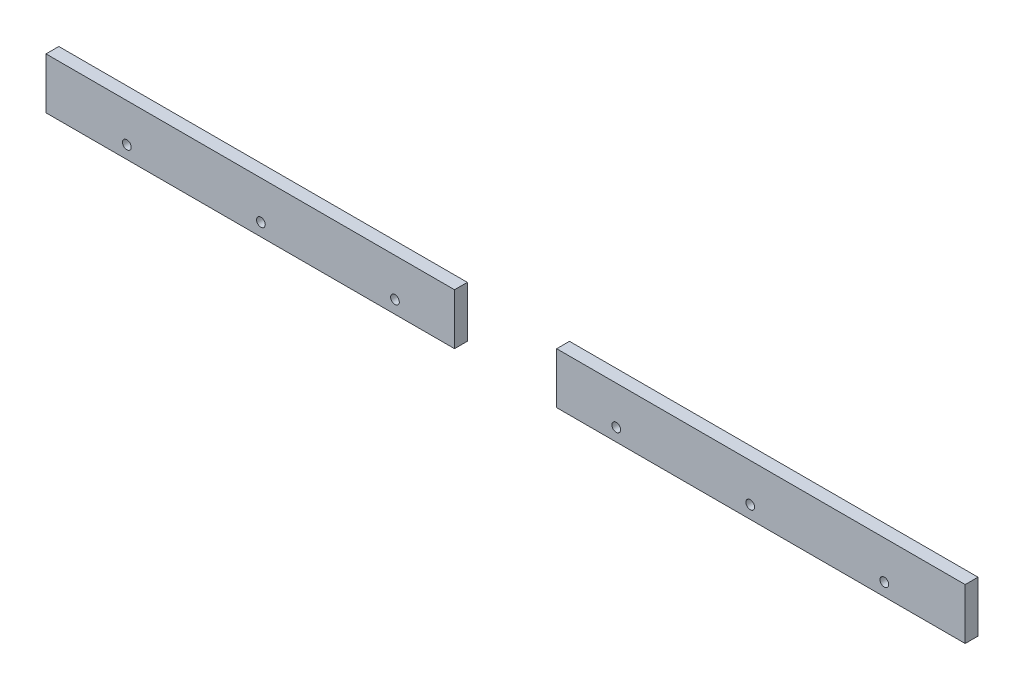
from build123d import *

# Parameters (mm, degrees)
SKETCH1_W           = 685.8
SKETCH1_H           = 38.1
BOSS_EXTRUDE1_DEPTH = 9.5631
SKETCH2_R           = 3.25
CUT_EXTRUDE1_DEPTH  = 9.5631
SKETCH4_W           = 76.2
SKETCH4_H           = 38.1
CUT_EXTRUDE2_DEPTH  = 9.5631


with BuildPart() as part:
    # Sketch1 → Boss-Extrude1 (new body)
    with BuildSketch(Plane.XY):
        Rectangle(SKETCH1_W, SKETCH1_H)
    extrude(amount=BOSS_EXTRUDE1_DEPTH)

    # Sketch2 → Cut-Extrude1 (cut)
    with BuildSketch(Plane.XY.offset(9.5631)):
        with Locations((-282.575, -9.525)):
            Circle(SKETCH2_R)
        with Locations((-182.5625, -9.525)):
            Circle(SKETCH2_R)
        with Locations((-82.55, -9.525)):
            Circle(SKETCH2_R)
    cut_extrude1 = extrude(amount=-CUT_EXTRUDE1_DEPTH, mode=Mode.SUBTRACT)

    # Mirror1: Cut-Extrude1 across plane
    add(cut_extrude1.mirror(Plane.ZY), mode=Mode.SUBTRACT)

    # Sketch4 → Cut-Extrude2 (cut)
    with BuildSketch(Plane.XY.offset(9.5631)):
        Rectangle(SKETCH4_W, SKETCH4_H)
    extrude(amount=-CUT_EXTRUDE2_DEPTH, mode=Mode.SUBTRACT)


with BuildPart() as cut_extrude2_piece_1:
    # of the separate pieces the step leaves, piece 1, a body of its own (cut_extrude2_pieces)
    add(part.part.solids().sort_by_distance((-342.9, -19.05, 0))[0])


with BuildPart() as cut_extrude2_piece_2:
    # of the separate pieces the step leaves, piece 2, a body of its own (cut_extrude2_pieces)
    add(part.part.solids().sort_by_distance((38.1, -19.05, 0))[0])


solid = Compound([cut_extrude2_piece_1.part, cut_extrude2_piece_2.part])
